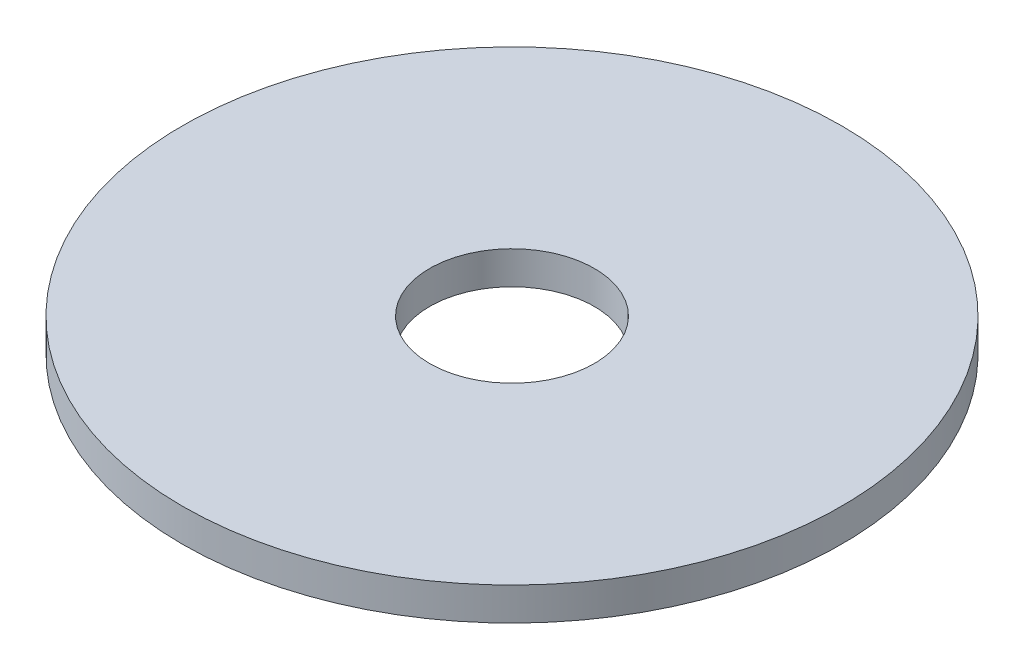
from build123d import *

# Parameters (mm, degrees)
SKETCH_1_R      = 10
SKETCH_1_R_2    = 2.5
EXTRUDE_1_DEPTH = 1


with BuildPart() as part:
    # 草图1 → 凸台-拉伸1 (new body)
    with BuildSketch(Plane(origin=(0, 0, 0), x_dir=(1, 0, 0), z_dir=(0, 1, 0))):
        with Locations(Location((0, 0, 0), (0, 0, 270))):
            Circle(SKETCH_1_R)
        with Locations(Location((0, 0, 0), (0, 0, 270))):
            Circle(SKETCH_1_R_2, mode=Mode.SUBTRACT)
    extrude(amount=EXTRUDE_1_DEPTH)


solid = part.part
